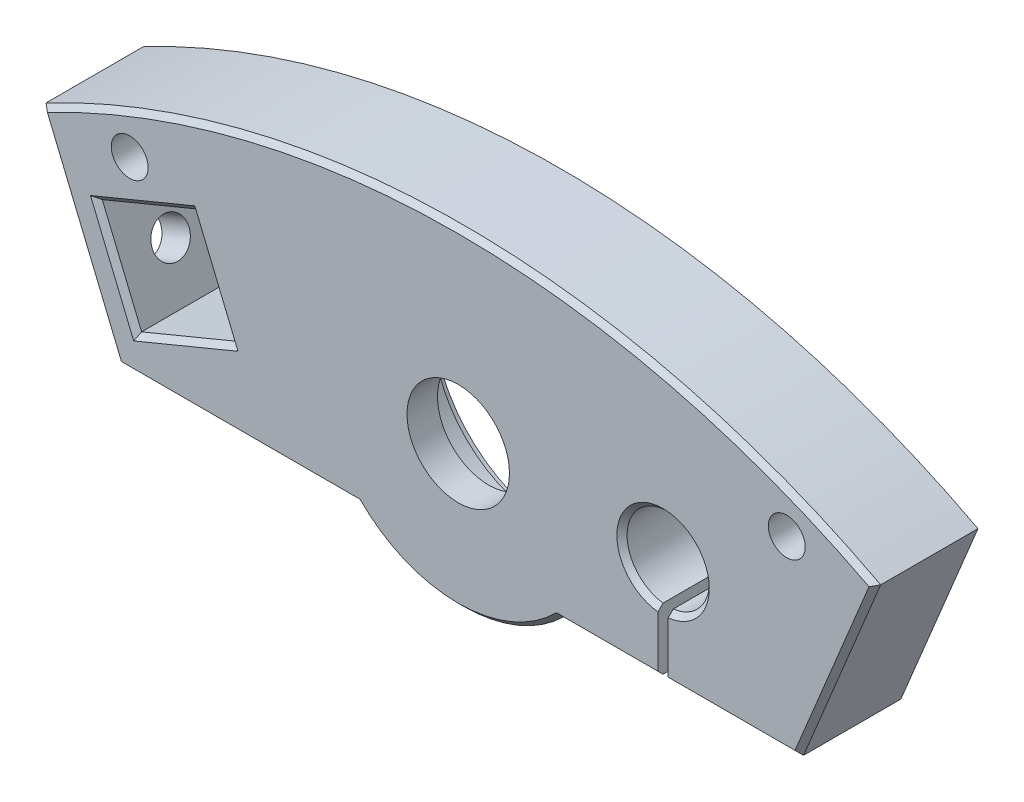
from build123d import *

# Parameters (mm, degrees)
SKETCH1_R           = 5
SKETCH1_R_2         = 1.8
BOSS_EXTRUDE1_DEPTH = 10
SKETCH3_R           = 11.025
CUT_EXTRUDE2_DEPTH  = 7.025
SKETCH4_R           = 12.525
CUT_EXTRUDE3_DEPTH  = 1.425
CHAMFER1_SIZE       = 0.5
SKETCH5_R           = 1.8
CUT_EXTRUDE4_DEPTH  = 10
CHAMFER2_SIZE       = 0.5


with BuildPart() as part:
    # Sketch1 → Boss-Extrude1 (new body)
    with BuildSketch(Plane.XY):
        with BuildLine():
            Line((-40.746699048, 8.183561953), (-33.214821075, -10))
            Line((-33.214821075, -10), (-9.797958971, -10))
            ThreePointArc((-9.797958971, -10), (0, -14), (9.797958971, -10))
            Line((9.797958971, -10), (19.5, -10))
            Line((19.5, -10), (19.5, -3.981225471))
            ThreePointArc((19.5, -3.981225471), (20, 4.0125), (20.5, -3.981225471))
            Line((20.5, -3.981225471), (20.5, -10))
            Line((20.5, -10), (33.214821075, -10))
            Line((33.214821075, -10), (40.746699048, 8.183561953))
            ThreePointArc((40.746699048, 8.183561953), (0, 18.25), (-40.746699048, 8.183561953))
        make_face()
        Circle(SKETCH1_R, mode=Mode.SUBTRACT)
        with Locations((-32.07645249, 8.189406634)):
            Circle(SKETCH1_R_2, mode=Mode.SUBTRACT)
        with Locations(Location((32.07645249, 8.189406634, 0), (0, 0, 180))):
            Circle(SKETCH1_R_2, mode=Mode.SUBTRACT)
        Polygon((-25.988511975, 6.5901118), (-35.250404289, 2.75371039), (-31.414002879, -6.508181923), (-22.152110566, -2.671780514), align=None, mode=Mode.SUBTRACT)
    extrude(amount=BOSS_EXTRUDE1_DEPTH)

    # Sketch3 → Cut-Extrude2 (cut)
    with BuildSketch(Plane(origin=(0, 0, 0), x_dir=(-1, 0, 0), z_dir=(0, 0, -1))):
        Circle(SKETCH3_R)
    extrude(amount=-CUT_EXTRUDE2_DEPTH, mode=Mode.SUBTRACT)

    # Sketch4 → Cut-Extrude3 (cut)
    with BuildSketch(Plane(origin=(0, 0, 0), x_dir=(-1, 0, 0), z_dir=(0, 0, -1))):
        Circle(SKETCH4_R)
    extrude(amount=-CUT_EXTRUDE3_DEPTH, mode=Mode.SUBTRACT)

    # Chamfer1
    chamfer1_edges = [part.edges().sort_by_distance(p)[0] for p in [
        (20, 4.0125, 10),
        (-24.070311271, 1.959165643, 10),
        (-30.619458132, 4.671911095, 10),
        (-33.332203584, -1.877235766, 10),
        (-26.783056723, -4.589981218, 10),
    ]]
    chamfer(chamfer1_edges, length=CHAMFER1_SIZE)

    # Sketch5 → Cut-Extrude4 (cut)
    with BuildSketch(Plane(origin=(-29.114518455, -12.059628406, 0), x_dir=(0, 0, -1), z_dir=(0.923879532511288, 0.3826834323650871, 0))):
        with Locations(Location((-4.75, 11.018842374, 0), (0, 0, 90))):
            Circle(SKETCH5_R)
    extrude(amount=-CUT_EXTRUDE4_DEPTH, mode=Mode.SUBTRACT)

    # Chamfer2
    chamfer2_edges = [part.edges().sort_by_distance(p)[0] for p in [
        (-36.980760062, -0.908219024, 10),
        (-21.506390023, -10, 10),
        (0, -14, 10),
        (14.648979486, -10, 10),
        (26.857410538, -10, 10),
        (36.980760062, -0.908219024, 10),
        (0, 18.25, 10),
    ]]
    chamfer(chamfer2_edges, length=CHAMFER2_SIZE)


solid = part.part
